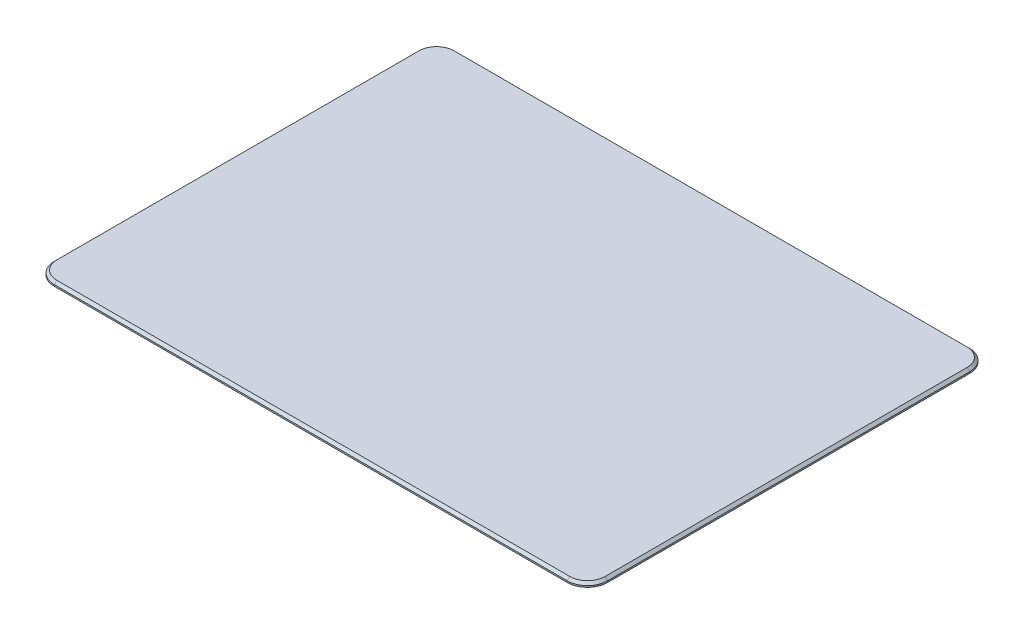
from build123d import *

# Parameters (mm, degrees)
SKETCH_1_W      = 550
SKETCH_1_H      = 400
EXTRUDE_1_DEPTH = 4
FILLET_1_R      = 20
CHAMFER_1_SIZE  = 2.5


with BuildPart() as part:
    # 스케치1 → 보스-돌출1 (new body)
    with BuildSketch(Plane(origin=(0, 0, 0), x_dir=(1, 0, 0), z_dir=(0, 1, 0))):
        Rectangle(SKETCH_1_W, SKETCH_1_H)
    extrude(amount=EXTRUDE_1_DEPTH)

    # 필렛1
    fillet_1_edges = [part.edges().sort_by_distance(p)[0] for p in [
        (275, 2, 200),
        (-275, 2, 200),
        (-275, 2, -200),
        (275, 2, -200),
    ]]
    fillet(fillet_1_edges, radius=FILLET_1_R)

    # 모따기1
    chamfer_1_edges = [part.edges().sort_by_distance(p)[0] for p in [
        (-275, 4, 0),
        (0, 4, -200),
        (275, 4, 0),
        (0, 4, 200),
        (269.142135624, 4, 194.142135624),
        (269.142135624, 4, -194.142135624),
        (-269.142135624, 4, 194.142135624),
        (-269.142135624, 4, -194.142135624),
    ]]
    chamfer(chamfer_1_edges, length=CHAMFER_1_SIZE)


solid = part.part
